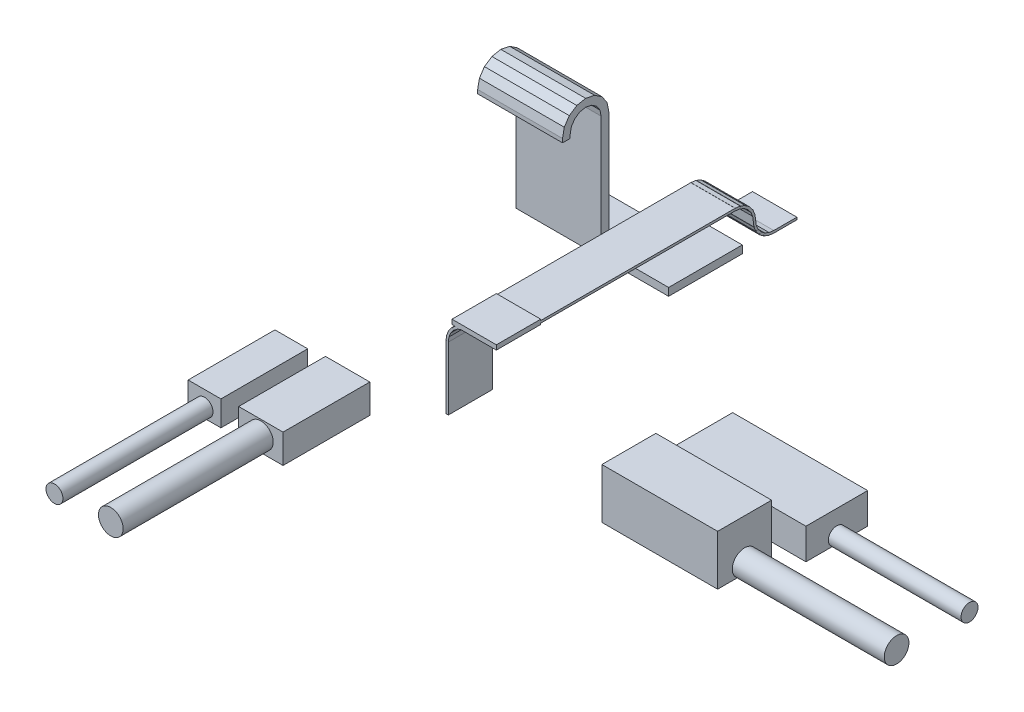
from build123d import *

# Parameters (mm, degrees)
SKETCH1_W                   = 8.5
SKETCH1_H                   = 6.5
PLUG_USBC_DEPTH             = 22.5
SKETCH2_R                   = 2.2
CABLE_USBC_DEPTH            = 39.4
SKETCH3_W                   = 11.5
SKETCH3_H                   = 7.5
PLUG_HDMI_DEPTH             = 22.5
SKETCH4_R                   = 3.2
CABLE_HDMI_DEPTH            = 39.4
SKETCH5_W                   = 14
SKETCH5_H                   = 13
PLUG_ETH_DEPTH              = 30
SKETCH6_R                   = 3.2
CABLE_ETH_DEPTH             = 39.9
SKETCH7_W                   = 16
SKETCH7_H                   = 8
PLUG_USBA_DEPTH             = 35
SKETCH8_R                   = 2.2
CABLE_USBA_DEPTH            = 34.9
SKETCH9_W                   = 6
SKETCH9_H                   = 0.6
RIBBON_0_DEPTH              = 11.5
RIBBON_1_DEPTH              = 11.5
RIBBON_2_DEPTH              = 11.5
RIBBON_3_DEPTH              = 11.5
RIBBON_4_DEPTH              = 11.5
RIBBON_5_DEPTH              = 11.5
RIBBON_6_DEPTH              = 11.5
RIBBON_7_DEPTH              = 11.5
RIBBON_8_DEPTH              = 11.5
RIBBON_9_DEPTH              = 11.5
RIBBON_10_DEPTH             = 11.5
RIBBON_11_DEPTH             = 11.5
RIBBON_12_DEPTH             = 11.5
SKETCH22_W                  = 56.15
SKETCH22_H                  = 0.6
RIBBON_13_DEPTH             = 11.5
SKETCH23_W                  = 11.5
SKETCH23_H                  = 11.5
RIBBON_FOLD_DEPTH           = 1.2
SKETCH24_W                  = 2
SKETCH24_H                  = 0.6
RIBBON_14_DEPTH             = 11.5
RIBBON_15_DEPTH             = 11.5
RIBBON_16_DEPTH             = 11.5
RIBBON_17_DEPTH             = 11.5
RIBBON_18_DEPTH             = 11.5
RIBBON_19_DEPTH             = 11.5
RIBBON_20_DEPTH             = 11.5
SKETCH31_W                  = 0.6
SKETCH31_H                  = 16.39
RIBBON_21_DEPTH             = 11.5
SKETCH32_W                  = 10
SKETCH32_H                  = 6
JUMPERS_WINDOW_DEPTH        = 2
SKETCH33_W                  = 39.5
SKETCH33_H                  = 13.1
JUMPERS_ACROSS_DEPTH        = 2
SKETCH34_W                  = 2
SKETCH34_H                  = 31.7
JUMPERS_RISE_DEPTH          = 22
JUMPERS_HAIRPIN_DEPTH       = 22
SKETCH36_W                  = 2
SKETCH36_H                  = 0.99
JUMPERS_INTO_HOUSINGS_DEPTH = 22


with BuildPart() as part:
    # Sketch1 → Plug usbc (new body)
    with BuildSketch(Plane.XY.offset(93)):
        with Locations((-43.8, -12.8)):
            Rectangle(SKETCH1_W, SKETCH1_H)
    extrude(amount=PLUG_USBC_DEPTH)

    # Sketch2 → Cable usbc (add)
    with BuildSketch(Plane.XY.offset(115)):
        with Locations((-43.8, -13.5)):
            Circle(SKETCH2_R)
    extrude(amount=CABLE_USBC_DEPTH)


with BuildPart() as body_2:
    # Sketch3 → Plug hdmi (new body)
    with BuildSketch(Plane.XY.offset(93)):
        with Locations((-29.2, -12.7)):
            Rectangle(SKETCH3_W, SKETCH3_H)
    extrude(amount=PLUG_HDMI_DEPTH)

    # Sketch4 → Cable hdmi (add)
    with BuildSketch(Plane.XY.offset(115)):
        with Locations((-29.2, -12.5)):
            Circle(SKETCH4_R)
    extrude(amount=CABLE_HDMI_DEPTH)


with BuildPart() as body_3:
    # Sketch5 → Plug eth (new body)
    with BuildSketch(Plane(origin=(33, 0, 0), x_dir=(0, 0, -1), z_dir=(1, 0, 0))):
        with Locations((-82.3, -7.6)):
            Rectangle(SKETCH5_W, SKETCH5_H)
    extrude(amount=PLUG_ETH_DEPTH)

    # Sketch6 → Cable eth (add)
    with BuildSketch(Plane(origin=(62.5, 0, 0), x_dir=(0, 0, -1), z_dir=(1, 0, 0))):
        with Locations(Location((-82.3, -11.5, 0), (0, 0, 234.340912304))):
            Circle(SKETCH6_R)
    extrude(amount=CABLE_ETH_DEPTH)


with BuildPart() as body_4:
    # Sketch7 → Plug usba (new body)
    with BuildSketch(Plane(origin=(33, 0, 0), x_dir=(0, 0, -1), z_dir=(1, 0, 0))):
        with Locations((-63.4, -10.4)):
            Rectangle(SKETCH7_W, SKETCH7_H)
    extrude(amount=PLUG_USBA_DEPTH)

    # Sketch8 → Cable usba (add)
    with BuildSketch(Plane(origin=(67.5, 0, 0), x_dir=(0, 0, -1), z_dir=(1, 0, 0))):
        with Locations(Location((-63.4, -12.5, 0), (0, 0, 239.727358681))):
            Circle(SKETCH8_R)
    extrude(amount=CABLE_USBA_DEPTH)


with BuildPart() as body_5:
    # Sketch9 → Ribbon 0 (new body)
    with BuildSketch(Plane(origin=(-5.35, 0, 0), x_dir=(0, 0, -1), z_dir=(1, 0, 0))):
        with Locations((-14.9, 2)):
            Rectangle(SKETCH9_W, SKETCH9_H)
    extrude(amount=RIBBON_0_DEPTH)

    # Sketch10 → Ribbon 1 (add)
    with BuildSketch(Plane(origin=(-5.35, 0, 0), x_dir=(0, 0, -1), z_dir=(1, 0, 0))):
        Polygon((-17.939157858, 1.702566542), (-19.233253083, 1.87293741), (-19.154937368, 2.467804327), (-17.860842142, 2.297433458), align=None)
    extrude(amount=RIBBON_1_DEPTH)

    # Sketch11 → Ribbon 2 (add)
    with BuildSketch(Plane(origin=(-5.35, 0, 0), x_dir=(0, 0, -1), z_dir=(1, 0, 0))):
        Polygon((-19.308900255, 1.893207009), (-20.51480503, 2.392709121), (-20.28519497, 2.947036841), (-19.079290196, 2.447534728), align=None)
    extrude(amount=RIBBON_2_DEPTH)

    # Sketch12 → Ribbon 3 (add)
    with BuildSketch(Plane(origin=(-5.35, 0, 0), x_dir=(0, 0, -1), z_dir=(1, 0, 0))):
        Polygon((-20.582628429, 2.431866979), (-21.618162335, 3.226460092), (-21.252905477, 3.702472096), (-20.217371571, 2.907878983), align=None)
    extrude(amount=RIBBON_3_DEPTH)

    # Sketch13 → Ribbon 4 (add)
    with BuildSketch(Plane(origin=(-5.35, 0, 0), x_dir=(0, 0, -1), z_dir=(1, 0, 0))):
        Polygon((-21.673539908, 3.281837665), (-22.468133021, 4.317371571), (-21.992121017, 4.682628429), (-21.197527904, 3.647094523), align=None)
    extrude(amount=RIBBON_4_DEPTH)

    # Sketch14 → Ribbon 5 (add)
    with BuildSketch(Plane(origin=(-5.35, 0, 0), x_dir=(0, 0, -1), z_dir=(1, 0, 0))):
        Polygon((-22.507290879, 4.38519497), (-23.006792991, 5.591099745), (-22.452465272, 5.820709804), (-21.952963159, 4.61480503), align=None)
    extrude(amount=RIBBON_5_DEPTH)

    # Sketch15 → Ribbon 6 (add)
    with BuildSketch(Plane(origin=(-5.35, 0, 0), x_dir=(0, 0, -1), z_dir=(1, 0, 0))):
        Polygon((-23.02706259, 5.666746917), (-23.197433458, 6.960842142), (-22.602566542, 7.039157858), (-22.432195673, 5.745062632), align=None)
    extrude(amount=RIBBON_6_DEPTH)

    # Sketch16 → Ribbon 7 (add)
    with BuildSketch(Plane(origin=(-5.35, 0, 0), x_dir=(0, 0, -1), z_dir=(1, 0, 0))):
        Polygon((-23.197433458, 6.960842142), (-23.367804327, 8.254937368), (-22.77293741, 8.333253083), (-22.602566542, 7.039157858), align=None)
    extrude(amount=RIBBON_7_DEPTH)

    # Sketch17 → Ribbon 8 (add)
    with BuildSketch(Plane(origin=(-5.35, 0, 0), x_dir=(0, 0, -1), z_dir=(1, 0, 0))):
        Polygon((-23.347534728, 8.179290196), (-23.847036841, 9.38519497), (-23.292709121, 9.61480503), (-22.793207009, 8.408900255), align=None)
    extrude(amount=RIBBON_8_DEPTH)

    # Sketch18 → Ribbon 9 (add)
    with BuildSketch(Plane(origin=(-5.35, 0, 0), x_dir=(0, 0, -1), z_dir=(1, 0, 0))):
        Polygon((-23.807878983, 9.317371571), (-24.602472096, 10.352905477), (-24.126460092, 10.718162335), (-23.331866979, 9.682628429), align=None)
    extrude(amount=RIBBON_9_DEPTH)

    # Sketch19 → Ribbon 10 (add)
    with BuildSketch(Plane(origin=(-5.35, 0, 0), x_dir=(0, 0, -1), z_dir=(1, 0, 0))):
        Polygon((-24.547094523, 10.297527904), (-25.582628429, 11.092121017), (-25.217371571, 11.568133021), (-24.181837665, 10.773539908), align=None)
    extrude(amount=RIBBON_10_DEPTH)

    # Sketch20 → Ribbon 11 (add)
    with BuildSketch(Plane(origin=(-5.35, 0, 0), x_dir=(0, 0, -1), z_dir=(1, 0, 0))):
        Polygon((-25.51480503, 11.052963159), (-26.720709804, 11.552465272), (-26.491099745, 12.106792991), (-25.28519497, 11.607290879), align=None)
    extrude(amount=RIBBON_11_DEPTH)

    # Sketch21 → Ribbon 12 (add)
    with BuildSketch(Plane(origin=(-5.35, 0, 0), x_dir=(0, 0, -1), z_dir=(1, 0, 0))):
        Polygon((-26.645062632, 11.532195673), (-27.939157858, 11.702566542), (-27.860842142, 12.297433458), (-26.566746917, 12.12706259), align=None)
    extrude(amount=RIBBON_12_DEPTH)

    # Sketch22 → Ribbon 13 (add)
    with BuildSketch(Plane(origin=(-5.35, 0, 0), x_dir=(0, 0, -1), z_dir=(1, 0, 0))):
        with Locations((-55.975, 12)):
            Rectangle(SKETCH22_W, SKETCH22_H)
    extrude(amount=RIBBON_13_DEPTH)

    # Sketch23 → Ribbon Fold (add)
    with BuildSketch(Plane(origin=(0, 11.4, 0), x_dir=(1, 0, 0), z_dir=(0, 1, 0))):
        with Locations((0.4, -84.05)):
            Rectangle(SKETCH23_W, SKETCH23_H)
    extrude(amount=RIBBON_FOLD_DEPTH)

    # Sketch24 → Ribbon 14 (add)
    with BuildSketch(Plane.XY.offset(78.3)):
        with Locations((-0.6, 12)):
            Rectangle(SKETCH24_W, SKETCH24_H)
    extrude(amount=RIBBON_14_DEPTH)

    # Sketch25 → Ribbon 15 (add)
    with BuildSketch(Plane.XY.offset(78.3)):
        Polygon((-1.560842142, 11.702566542), (-2.854937368, 11.532195673), (-2.933253083, 12.12706259), (-1.639157858, 12.297433458), align=None)
    extrude(amount=RIBBON_15_DEPTH)

    # Sketch26 → Ribbon 16 (add)
    with BuildSketch(Plane.XY.offset(78.3)):
        Polygon((-2.779290196, 11.552465272), (-3.98519497, 11.052963159), (-4.21480503, 11.607290879), (-3.008900255, 12.106792991), align=None)
    extrude(amount=RIBBON_16_DEPTH)

    # Sketch27 → Ribbon 17 (add)
    with BuildSketch(Plane.XY.offset(78.3)):
        Polygon((-3.917371571, 11.092121017), (-4.952905477, 10.297527904), (-5.318162335, 10.773539908), (-4.282628429, 11.568133021), align=None)
    extrude(amount=RIBBON_17_DEPTH)

    # Sketch28 → Ribbon 18 (add)
    with BuildSketch(Plane.XY.offset(78.3)):
        Polygon((-4.897527904, 10.352905477), (-5.692121017, 9.317371571), (-6.168133021, 9.682628429), (-5.373539908, 10.718162335), align=None)
    extrude(amount=RIBBON_18_DEPTH)

    # Sketch29 → Ribbon 19 (add)
    with BuildSketch(Plane.XY.offset(78.3)):
        Polygon((-5.652963159, 9.38519497), (-6.152465272, 8.179290196), (-6.706792991, 8.408900255), (-6.207290879, 9.61480503), align=None)
    extrude(amount=RIBBON_19_DEPTH)

    # Sketch30 → Ribbon 20 (add)
    with BuildSketch(Plane.XY.offset(78.3)):
        Polygon((-6.132195673, 8.254937368), (-6.302566542, 6.960842142), (-6.897433458, 7.039157858), (-6.72706259, 8.333253083), align=None)
    extrude(amount=RIBBON_20_DEPTH)

    # Sketch31 → Ribbon 21 (add)
    with BuildSketch(Plane.XY.offset(78.3)):
        with Locations((-6.6, -1.195)):
            Rectangle(SKETCH31_W, SKETCH31_H)
    extrude(amount=RIBBON_21_DEPTH)


with BuildPart() as body_6:
    # Sketch32 → Jumpers Window (new body)
    with BuildSketch(Plane(origin=(0, -13, 0), x_dir=(1, 0, 0), z_dir=(0, 1, 0))):
        with Locations((-13, -14.9)):
            Rectangle(SKETCH32_W, SKETCH32_H)
    extrude(amount=JUMPERS_WINDOW_DEPTH)

    # Sketch33 → Jumpers Across (add)
    with BuildSketch(Plane(origin=(0, -13, 0), x_dir=(1, 0, 0), z_dir=(0, 1, 0))):
        with Locations((-27.75, -24.45)):
            Rectangle(SKETCH33_W, SKETCH33_H)
    extrude(amount=JUMPERS_ACROSS_DEPTH)

    # Sketch34 → Jumpers Rise (add)
    with BuildSketch(Plane(origin=(-47.5, 0, 0), x_dir=(0, 0, -1), z_dir=(1, 0, 0))):
        with Locations((-30, 2.85)):
            Rectangle(SKETCH34_W, SKETCH34_H)
    extrude(amount=JUMPERS_RISE_DEPTH)

    # Sketch35 → Jumpers Hairpin (add)
    with BuildSketch(Plane(origin=(-47.5, 0, 0), x_dir=(0, 0, -1), z_dir=(1, 0, 0))):
        Polygon((-29, 18.7), (-29.456722805, 20.996100594), (-30.757359313, 22.942640687), (-32.703899406, 24.243277195), (-35, 24.7), (-37.296100594, 24.243277195), (-39.242640687, 22.942640687), (-40.543277195, 20.996100594), (-41, 18.7), (-39, 18.7), (-38.69551813, 20.230733729), (-37.828427125, 21.528427125), (-36.530733729, 22.39551813), (-35, 22.7), (-33.469266271, 22.39551813), (-32.171572875, 21.528427125), (-31.30448187, 20.230733729), (-31, 18.7), align=None)
    extrude(amount=JUMPERS_HAIRPIN_DEPTH)

    # Sketch36 → Jumpers Into Housings (add)
    with BuildSketch(Plane(origin=(-47.5, 0, 0), x_dir=(0, 0, -1), z_dir=(1, 0, 0))):
        with Locations((-40, 18.205)):
            Rectangle(SKETCH36_W, SKETCH36_H)
    extrude(amount=JUMPERS_INTO_HOUSINGS_DEPTH)


solid = Compound([part.part, body_2.part, body_3.part, body_4.part, body_5.part, body_6.part])
